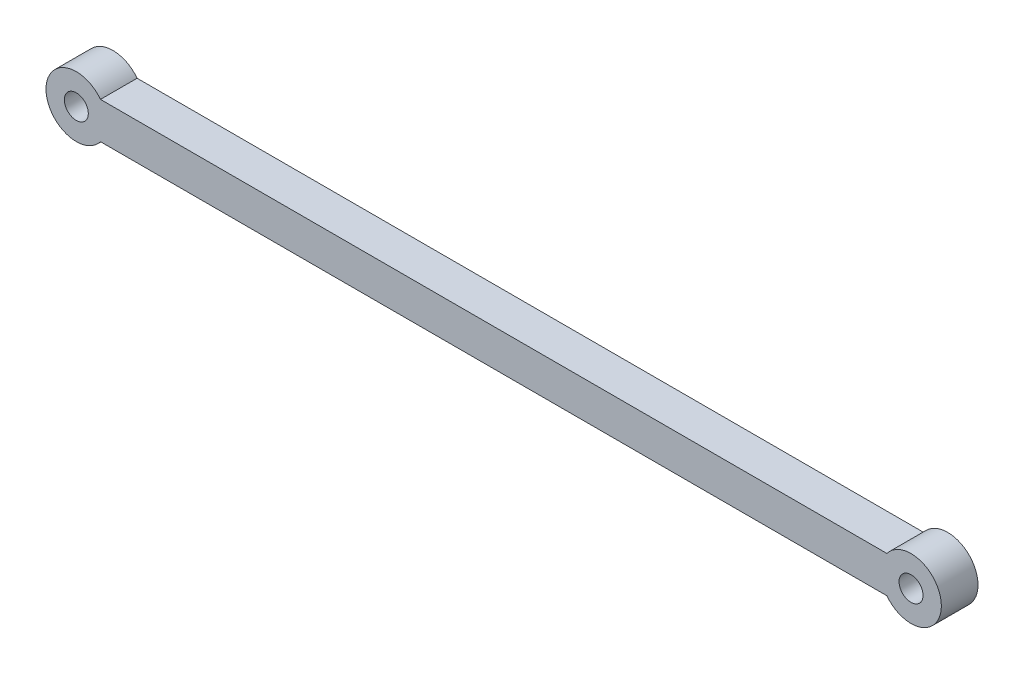
from build123d import *

# Parameters (mm, degrees)
SKETCH3_R           = 18.15695
SKETCH3_W           = 471.0727278
SKETCH3_H           = 21.9525
BOSS_EXTRUDE1_DEPTH = 10.97625
SKETCH4_R           = 7.1807
CUT_EXTRUDE1_DEPTH  = 645.139348927


with BuildPart() as part:
    # Sketch3 → Boss-Extrude1 (new, symmetric)
    with BuildSketch(Plane.XY):
        with Locations((-625.352112676, 0)):
            Circle(SKETCH3_R)
        with Locations((-125.352112676, 0)):
            Circle(SKETCH3_R)
        with Locations((-375.352112676, 0)):
            Rectangle(SKETCH3_W, SKETCH3_H)
    extrude(amount=BOSS_EXTRUDE1_DEPTH, both=True)

    # Sketch4 → Cut-Extrude1 (cut, through all)
    with BuildSketch(Plane.XY.offset(10.97625)):
        with Locations((-625.352112676, 0)):
            Circle(SKETCH4_R)
        with Locations((-125.352112676, 0)):
            Circle(SKETCH4_R)
    extrude(amount=-CUT_EXTRUDE1_DEPTH, mode=Mode.SUBTRACT)


solid = part.part
